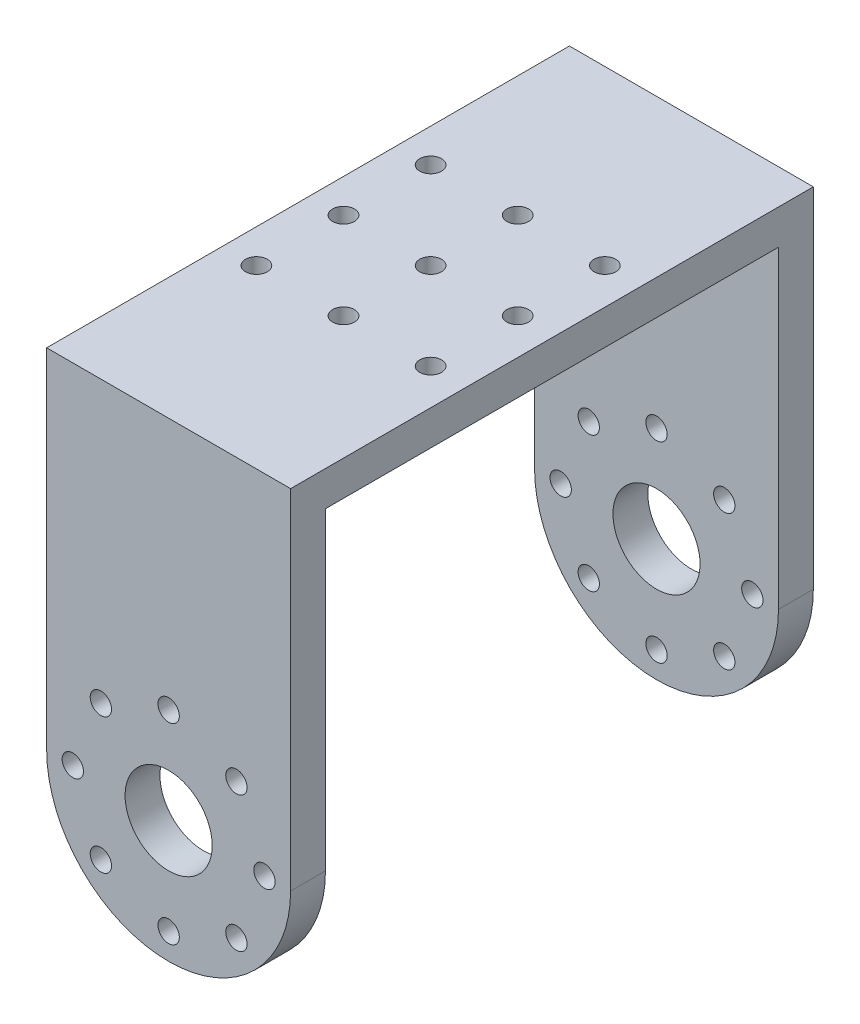
from build123d import *

# Parameters (mm, degrees)
SKETCH_2_R          = 5
SKETCH_2_R_2        = 1.225
EXTRUDE_1_DEPTH     = 60
SKETCH_9_W          = 52
SKETCH_9_H          = 50
CUT_EXTRUDE_1_DEPTH = 60
SKETCH_11_R         = 1.25
CUT_EXTRUDE_3_DEPTH = 60


with BuildPart() as part:
    # 스케치2 → 보스-돌출1 (new body)
    with BuildSketch(Plane.XY):
        with BuildLine():
            Line((-14, 0), (-14, 40))
            Line((-14, 40), (14, 40))
            Line((14, 40), (14, 0))
            ThreePointArc((14, 0), (0, -14), (-14, 0))
        make_face()
        Circle(SKETCH_2_R, mode=Mode.SUBTRACT)
        with Locations((0, 11)):
            Circle(SKETCH_2_R_2, mode=Mode.SUBTRACT)
        with Locations((7.778174593, 7.778174593)):
            Circle(SKETCH_2_R_2, mode=Mode.SUBTRACT)
        with Locations((11, 0)):
            Circle(SKETCH_2_R_2, mode=Mode.SUBTRACT)
        with Locations((7.778174593, -7.778174593)):
            Circle(SKETCH_2_R_2, mode=Mode.SUBTRACT)
        with Locations((0, -11)):
            Circle(SKETCH_2_R_2, mode=Mode.SUBTRACT)
        with Locations((-7.778174593, -7.778174593)):
            Circle(SKETCH_2_R_2, mode=Mode.SUBTRACT)
        with Locations((-11, 0)):
            Circle(SKETCH_2_R_2, mode=Mode.SUBTRACT)
        with Locations((-7.778174593, 7.778174593)):
            Circle(SKETCH_2_R_2, mode=Mode.SUBTRACT)
    extrude(amount=EXTRUDE_1_DEPTH)

    # 스케치9 → 컷-돌출1 (cut)
    with BuildSketch(Plane(origin=(14, 0, 0), x_dir=(0, 0, -1), z_dir=(1, 0, 0))):
        with Locations((-30, 11)):
            Rectangle(SKETCH_9_W, SKETCH_9_H)
    extrude(amount=-CUT_EXTRUDE_1_DEPTH, mode=Mode.SUBTRACT)

    # 스케치11 → 컷-돌출3 (cut)
    with BuildSketch(Plane(origin=(0, 40, 0), x_dir=(1, 0, 0), z_dir=(0, 1, 0))):
        with Locations(Location((-10.142727679, -39.786307008, 0), (0, 0, 270))):
            Circle(SKETCH_11_R)
        with Locations(Location((-10.142727679, -19.786307008, 0), (0, 0, 270))):
            Circle(SKETCH_11_R)
        with Locations(Location((-10.142727679, -29.786307008, 0), (0, 0, 270))):
            Circle(SKETCH_11_R)
        with Locations(Location((-0.142727679, -39.786307008, 0), (0, 0, 270))):
            Circle(SKETCH_11_R)
        with Locations(Location((-0.142727679, -29.786307008, 0), (0, 0, 270))):
            Circle(SKETCH_11_R)
        with Locations(Location((-0.142727679, -19.786307008, 0), (0, 0, 270))):
            Circle(SKETCH_11_R)
        with Locations(Location((9.857272321, -19.786307008, 0), (0, 0, 270))):
            Circle(SKETCH_11_R)
        with Locations(Location((9.857272321, -29.786307008, 0), (0, 0, 270))):
            Circle(SKETCH_11_R)
        with Locations(Location((9.857272321, -39.786307008, 0), (0, 0, 270))):
            Circle(SKETCH_11_R)
    extrude(amount=-CUT_EXTRUDE_3_DEPTH, mode=Mode.SUBTRACT)


solid = part.part
